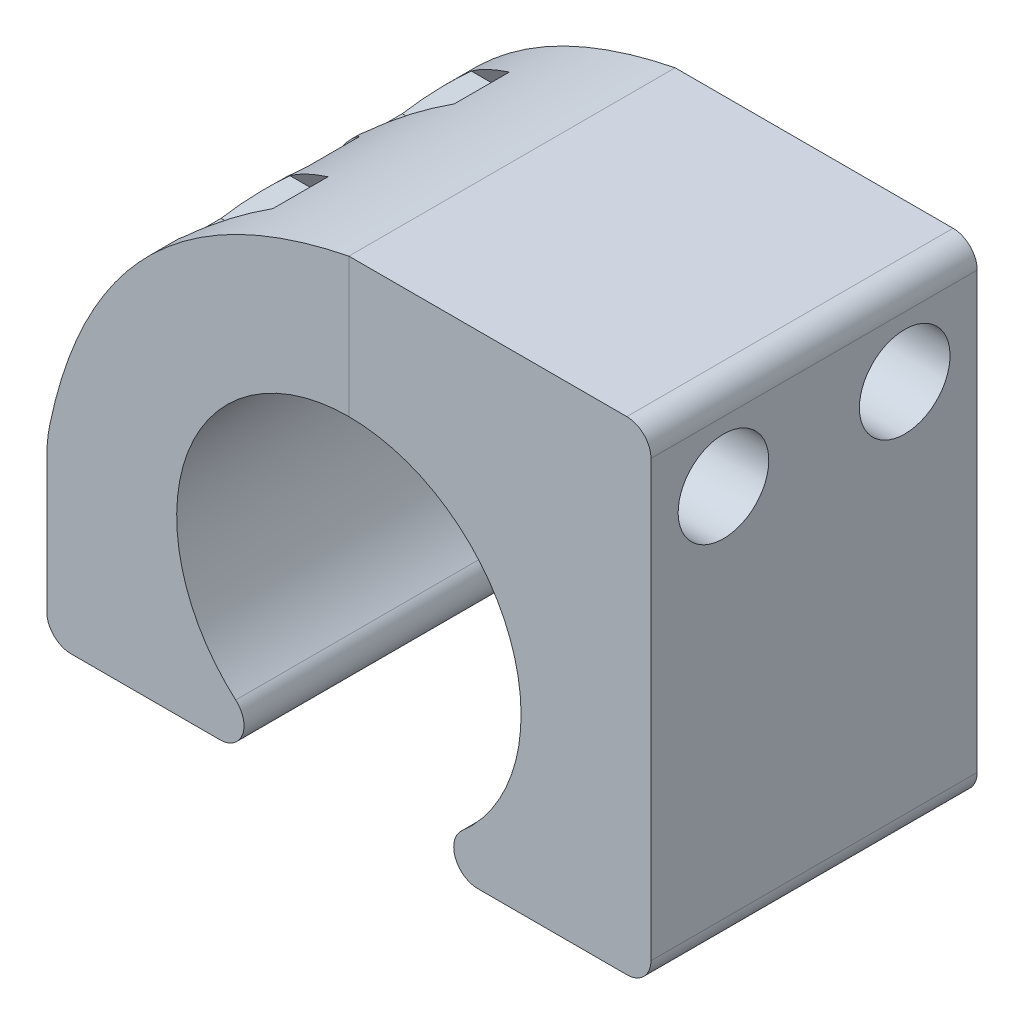
from build123d import *

# Parameters (mm, degrees)
BOSS_EXTRUDE1_DEPTH    = 13.5
FILLET1_R              = 2
SPLIT1_SURFACE_1_BACK  = 70.491
SPLIT1_SURFACE_1_DEPTH = 140.982
SPLIT1_SURFACE_2_BACK  = 70.491
SPLIT1_SURFACE_2_DEPTH = 140.982
SKETCH3_R              = 3.75
CUT_EXTRUDE1_DEPTH     = 10
SKETCH7_R              = 2.25
CUT_EXTRUDE3_DEPTH     = 15
CUT_EXTRUDE2_DEPTH     = 27
FILLET2_R              = 12
SKETCH8_R              = 2.25
CUT_EXTRUDE4_DEPTH     = 25
CUT_EXTRUDE5_DEPTH     = 15
SKETCH10_R             = 2.25
CUT_EXTRUDE6_DEPTH     = 35
CUT_EXTRUDE7_DEPTH     = 17


with BuildPart() as part:
    # Sketch1 → Boss-Extrude1 (new, symmetric)
    with BuildSketch(Plane.XY):
        with BuildLine():
            Line((10.677078252, -14.25), (25, -14.25))
            Line((25, -14.25), (25, 25.75))
            Line((25, 25.75), (-25, 25.75))
            Line((-25, 25.75), (-25, -14.25))
            Line((-25, -14.25), (-10.677078252, -14.25))
            ThreePointArc((-10.677078252, -14.25), (-8.804194831, -12.951646415), (-9.362976313, -10.742307692))
            ThreePointArc((-9.362976313, -10.742307692), (0, 14.25), (9.362976313, -10.742307692))
            ThreePointArc((9.362976313, -10.742307692), (8.804194831, -12.951646415), (10.677078252, -14.25))
        make_face()
    extrude(amount=BOSS_EXTRUDE1_DEPTH, both=True)

    # Fillet1
    fillet1_edges = [part.edges().sort_by_distance(p)[0] for p in [
        (25, 25.75, 0),
        (25, -14.25, 0),
        (-25, -14.25, 0),
    ]]
    fillet(fillet1_edges, radius=FILLET1_R)


with BuildPart() as body_2:
    # Split1: the piece behind the surface
    add(part.part)
    # Split1 surface: a surface, the sketch's curves swept straight by 140.982 mm
    with BuildLine(Plane.XY.offset(13.5).offset(-SPLIT1_SURFACE_1_BACK), mode=Mode.PRIVATE) as split1_surface_1_path:
        Line((0, 25.75), (0, 0))
    split1_surface_1 = Shell.extrude(split1_surface_1_path.wire(), (0 * SPLIT1_SURFACE_1_DEPTH, 0 * SPLIT1_SURFACE_1_DEPTH, 1 * SPLIT1_SURFACE_1_DEPTH))
    split(bisect_by=split1_surface_1, keep=Keep.BOTTOM)

    # Sketch6 → Cut-Extrude2 (cut)
    with BuildSketch(Plane.XY.offset(13.5)):
        with BuildLine():
            Line((-25, 25.75), (-25, 0))
            add(Edge.make_bspline(
                [(0, 25.75), (-21.163856035, 21.538520056), (-25, 0)],
                knots=[0, 0, 0, 1, 1, 1], degree=2))
            Line((0, 25.75), (-25, 25.75))
        make_face()
    extrude(amount=-CUT_EXTRUDE2_DEPTH, mode=Mode.SUBTRACT)

    # Fillet2
    fillet2_edges = [body_2.edges().sort_by_distance(p)[0] for p in [
        (-25, 0, 0),
    ]]
    fillet(fillet2_edges, radius=FILLET2_R)

    # Sketch8 → Cut-Extrude4 (cut)
    with BuildSketch(Plane(origin=(0, 0, 0), x_dir=(0, 0, -1), z_dir=(1, 0, 0))):
        with Locations(Location((7.5, 18.75, 0), (0, 0, 90))):
            Circle(SKETCH8_R)
        with Locations(Location((-7.5, 18.75, 0), (0, 0, 90))):
            Circle(SKETCH8_R)
    extrude(amount=-CUT_EXTRUDE4_DEPTH, mode=Mode.SUBTRACT)

    # Sketch9 → Cut-Extrude5 (cut)
    with BuildSketch(Plane.ZY.offset(25)):
        Polygon((-5.334936491, 22.5), (-9.665063509, 22.5), (-11.830127019, 18.75), (-9.665063509, 15), (-5.334936491, 15), (-3.169872981, 18.75), align=None)
        Polygon((3.169872981, 18.75), (5.334936491, 22.5), (9.665063509, 22.5), (11.830127019, 18.75), (9.665063509, 15), (5.334936491, 15), align=None)
    extrude(amount=-CUT_EXTRUDE5_DEPTH, mode=Mode.SUBTRACT)

    # Sketch10 → Cut-Extrude6 (cut)
    with BuildSketch(Plane.XZ.offset(14.25)):
        with Locations((-18.5, 0)):
            Circle(SKETCH10_R)
    extrude(amount=-CUT_EXTRUDE6_DEPTH, mode=Mode.SUBTRACT)

    # Sketch11 → Cut-Extrude7 (cut)
    with BuildSketch(Plane(origin=(0, 25.75, 0), x_dir=(1, 0, 0), z_dir=(0, 1, 0))):
        Polygon((-14.75, -2.165063509), (-14.75, 2.165063509), (-18.5, 4.330127019), (-22.25, 2.165063509), (-22.25, -2.165063509), (-18.5, -4.330127019), align=None)
    extrude(amount=-CUT_EXTRUDE7_DEPTH, mode=Mode.SUBTRACT)


with BuildPart() as part_1:
    add(part.part)

    # Split1: split by a surface, the side it looks to stays
    # Split1 surface: a surface, the sketch's curves swept straight by 140.982 mm
    with BuildLine(Plane.XY.offset(13.5).offset(-SPLIT1_SURFACE_2_BACK), mode=Mode.PRIVATE) as split1_surface_2_path:
        Line((0, 25.75), (0, 0))
    split1_surface_2 = Shell.extrude(split1_surface_2_path.wire(), (0 * SPLIT1_SURFACE_2_DEPTH, 0 * SPLIT1_SURFACE_2_DEPTH, 1 * SPLIT1_SURFACE_2_DEPTH))
    split(bisect_by=split1_surface_2, keep=Keep.TOP)

    # Sketch3 → Cut-Extrude1 (cut)
    with BuildSketch(Plane(origin=(25, 0, 0), x_dir=(0, 0, -1), z_dir=(1, 0, 0))):
        with Locations(Location((-7.5, 18.75, 0), (0, 0, 90))):
            Circle(SKETCH3_R)
        with Locations(Location((7.5, 18.75, 0), (0, 0, 180))):
            Circle(SKETCH3_R)
    extrude(amount=-CUT_EXTRUDE1_DEPTH, mode=Mode.SUBTRACT)

    # Sketch7 → Cut-Extrude3 (cut)
    with BuildSketch(Plane(origin=(15, 0, 0), x_dir=(0, 0, -1), z_dir=(1, 0, 0))):
        with Locations((-7.5, 18.75)):
            Circle(SKETCH7_R)
        with Locations(Location((7.5, 18.75, 0), (0, 0, 180))):
            Circle(SKETCH7_R)
    extrude(amount=-CUT_EXTRUDE3_DEPTH, mode=Mode.SUBTRACT)


solid = Compound([body_2.part, part_1.part])
